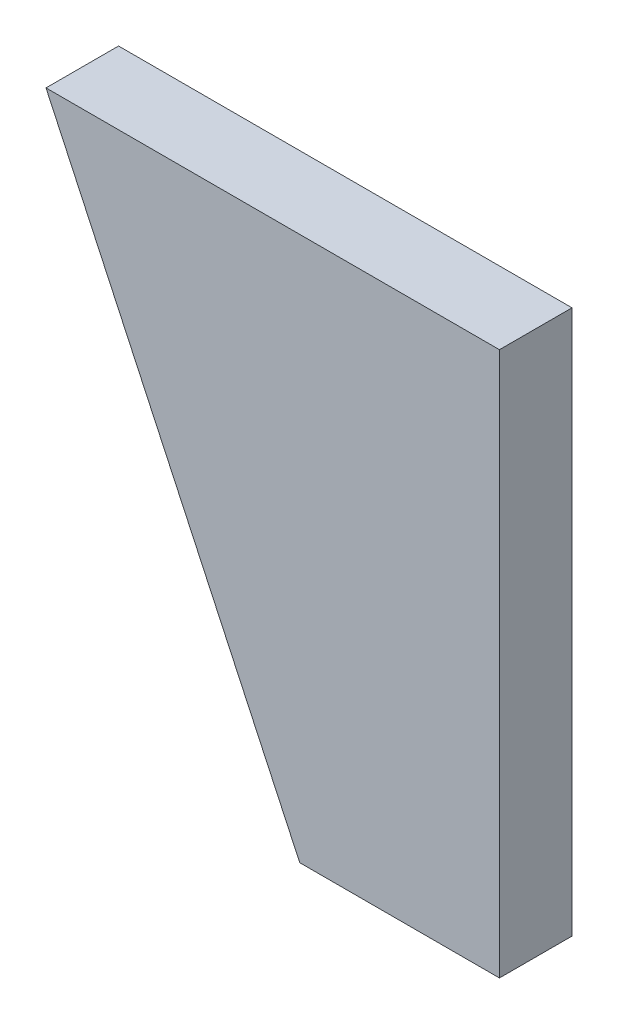
from build123d import *

# Parameters (mm, degrees)
EXTRUDE_1_DEPTH = 2


with BuildPart() as part:
    # Эскиз2 → Бобышка-Вытянуть1 (new, symmetric)
    with BuildSketch(Plane.XY):
        Polygon((53, 85), (53, 55), (41.989229745, 55), (28, 85), align=None)
    extrude(amount=EXTRUDE_1_DEPTH, both=True)


solid = part.part
